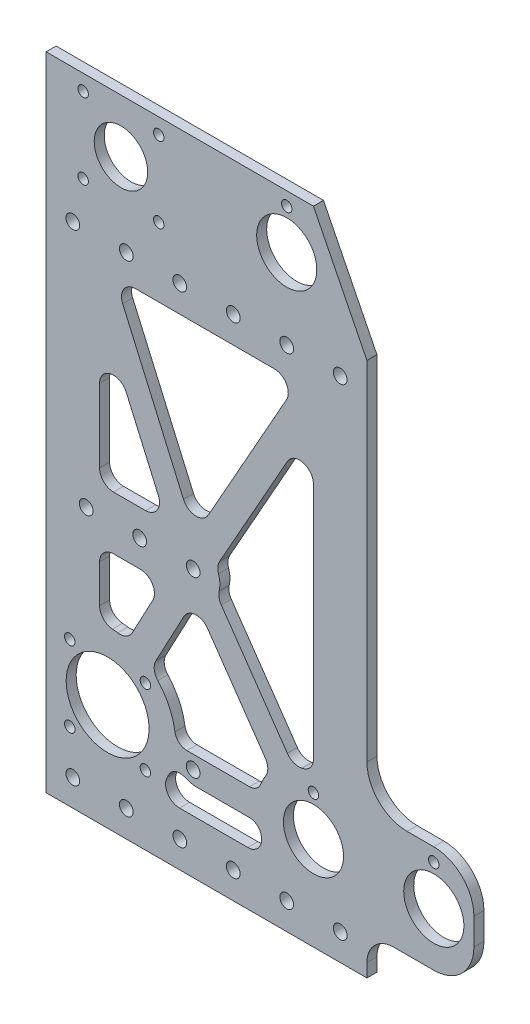
from build123d import *

# Parameters (mm, degrees)
SKETCH1_R           = 3.2639
SKETCH1_R_2         = 14.2875
SKETCH1_R_3         = 2.4892
SKETCH1_R_4         = 12.7
SKETCH1_R_5         = 19.685
BOSS_EXTRUDE1_DEPTH = 4.7625
CUT_EXTRUDE1_DEPTH  = 262.552368382


with BuildPart() as part:
    # Sketch1 → Boss-Extrude1 (new body)
    with BuildSketch(Plane.XY):
        with BuildLine():
            Line((76.2, 0), (76.2, 25.4))
            Line((76.2, 25.4), (50.8, 76.2))
            Line((50.8, 76.2), (12.7, 76.2))
            Line((12.7, 76.2), (-76.2, 76.2))
            Line((-76.2, 76.2), (-76.2, 0))
            Line((-76.2, 0), (-76.2, -228.6))
            Line((-76.2, -228.6), (0, -228.6))
            Line((0, -228.6), (76.2, -228.6))
            Line((76.2, -228.6), (76.2, -222.25))
            ThreePointArc((76.2, -222.25), (79.919743879, -213.269743879), (88.9, -209.55))
            Line((88.9, -209.55), (107.95, -209.55))
            ThreePointArc((107.95, -209.55), (121.420384182, -203.970384182), (127, -190.5))
            Line((127, -190.5), (127, -177.8))
            ThreePointArc((127, -177.8), (121.420384182, -164.329615818), (107.95, -158.75))
            Line((107.95, -158.75), (95.25, -158.75))
            ThreePointArc((95.25, -158.75), (81.779615818, -153.170384182), (76.2, -139.7))
            Line((76.2, -139.7), (76.2, 0))
        make_face()
        with Locations(Location((-38.1, 12.7, 0), (0, 0, 180))):
            Circle(SKETCH1_R, mode=Mode.SUBTRACT)
        with Locations(Location((-12.7, 12.7, 0), (0, 0, 180))):
            Circle(SKETCH1_R, mode=Mode.SUBTRACT)
        with Locations(Location((-63.5, 12.7, 0), (0, 0, 180))):
            Circle(SKETCH1_R, mode=Mode.SUBTRACT)
        with Locations(Location((12.7, 12.7, 0), (0, 0, 180))):
            Circle(SKETCH1_R, mode=Mode.SUBTRACT)
        with Locations(Location((38.1, 12.7, 0), (0, 0, 180))):
            Circle(SKETCH1_R, mode=Mode.SUBTRACT)
        with Locations(Location((38.1, 50.8, 0), (0, 0, 180))):
            Circle(SKETCH1_R_2, mode=Mode.SUBTRACT)
        with Locations(Location((-22.679487758, 32.839487758, 0), (0, 0, 180))):
            Circle(SKETCH1_R_3, mode=Mode.SUBTRACT)
        with Locations(Location((-58.600512242, 32.839487758, 0), (0, 0, 180))):
            Circle(SKETCH1_R_3, mode=Mode.SUBTRACT)
        with Locations(Location((-58.600512242, 68.760512242, 0), (0, 0, 180))):
            Circle(SKETCH1_R_3, mode=Mode.SUBTRACT)
        with Locations(Location((-22.679487758, 68.760512242, 0), (0, 0, 180))):
            Circle(SKETCH1_R_3, mode=Mode.SUBTRACT)
        with Locations(Location((63.5, 12.7, 0), (0, 0, 180))):
            Circle(SKETCH1_R, mode=Mode.SUBTRACT)
        with Locations(Location((-40.64, 50.8, 0), (0, 0, 180))):
            Circle(SKETCH1_R_4, mode=Mode.SUBTRACT)
        with Locations(Location((50.8, -184.15, 0), (0, 0, 180))):
            Circle(SKETCH1_R_2, mode=Mode.SUBTRACT)
        with Locations(Location((63.5, -215.9, 0), (0, 0, 180))):
            Circle(SKETCH1_R, mode=Mode.SUBTRACT)
        with Locations(Location((38.1, -215.9, 0), (0, 0, 180))):
            Circle(SKETCH1_R, mode=Mode.SUBTRACT)
        with Locations(Location((12.7, -215.9, 0), (0, 0, 180))):
            Circle(SKETCH1_R, mode=Mode.SUBTRACT)
        with Locations(Location((50.8, -165.1, 0), (0, 0, 180))):
            Circle(SKETCH1_R_3, mode=Mode.SUBTRACT)
        with Locations(Location((38.1, 69.85, 0), (0, 0, 180))):
            Circle(SKETCH1_R_3, mode=Mode.SUBTRACT)
        with Locations(Location((-6.35, -184.15, 0), (0, 0, 180))):
            Circle(SKETCH1_R, mode=Mode.SUBTRACT)
        with Locations(Location((107.95, -184.15, 0), (0, 0, 180))):
            Circle(SKETCH1_R_2, mode=Mode.SUBTRACT)
        with Locations(Location((107.95, -165.1, 0), (0, 0, 180))):
            Circle(SKETCH1_R_3, mode=Mode.SUBTRACT)
        with Locations(Location((-57.15, -101.6, 0), (0, 0, 180))):
            Circle(SKETCH1_R, mode=Mode.SUBTRACT)
        with Locations(Location((-31.75, -101.6, 0), (0, 0, 180))):
            Circle(SKETCH1_R, mode=Mode.SUBTRACT)
        with Locations(Location((-6.35, -101.6, 0), (0, 0, 180))):
            Circle(SKETCH1_R, mode=Mode.SUBTRACT)
        with Locations(Location((-46.99, -177.8, 0), (0, 0, 180))):
            Circle(SKETCH1_R_5, mode=Mode.SUBTRACT)
        with Locations(Location((-29.029487758, -195.760512242, 0), (0, 0, 180))):
            Circle(SKETCH1_R_3, mode=Mode.SUBTRACT)
        with Locations(Location((-64.950512242, -195.760512242, 0), (0, 0, 180))):
            Circle(SKETCH1_R_3, mode=Mode.SUBTRACT)
        with Locations(Location((-64.950512242, -159.839487758, 0), (0, 0, 180))):
            Circle(SKETCH1_R_3, mode=Mode.SUBTRACT)
        with Locations(Location((-29.029487758, -159.839487758, 0), (0, 0, 180))):
            Circle(SKETCH1_R_3, mode=Mode.SUBTRACT)
        with Locations(Location((-12.7, -215.9, 0), (0, 0, 180))):
            Circle(SKETCH1_R, mode=Mode.SUBTRACT)
        with Locations(Location((-38.1, -215.9, 0), (0, 0, 180))):
            Circle(SKETCH1_R, mode=Mode.SUBTRACT)
        with Locations(Location((-63.5, -215.9, 0), (0, 0, 180))):
            Circle(SKETCH1_R, mode=Mode.SUBTRACT)
    extrude(amount=BOSS_EXTRUDE1_DEPTH)

    # Sketch2 → Cut-Extrude1 (cut, through all)
    with BuildSketch(Plane.XY.offset(4.7625)):
        with BuildLine():
            Line((-12.83077716, -203.2), (19.59926353, -203.2))
            ThreePointArc((19.59926353, -203.2), (25.066064138, -200.300984091), (25.733245747, -194.149149338))
            ThreePointArc((25.733245747, -194.149149338), (25.724761885, -194.127854967), (25.716296113, -194.106553398))
            ThreePointArc((25.716296113, -194.106553398), (23.61470625, -191.486839822), (20.404452937, -190.5))
            Line((20.404452937, -190.5), (-5.477828576, -190.5))
            ThreePointArc((-5.477828576, -190.5), (-6.340017557, -190.434588937), (-7.182470162, -190.239853074))
            Line((-7.182470162, -190.239853074), (-11.035754343, -189.035701768))
            ThreePointArc((-11.035754343, -189.035701768), (-15.003916575, -189.242917347), (-17.877836539, -191.986971616))
            ThreePointArc((-17.877836539, -191.986971616), (-18.23843644, -192.704221477), (-18.616704156, -193.412312704))
            ThreePointArc((-18.616704156, -193.412312704), (-18.515752398, -199.956635736), (-12.83077716, -203.2))
        make_face()
        with BuildLine():
            ThreePointArc((37.978395534, -9.841685227), (37.923146144, -3.269997693), (32.222510687, 0))
            Line((32.222510687, 0), (-33.771257244, 0))
            ThreePointArc((-33.771257244, 0), (-39.298175647, -2.989309284), (-39.821560284, -9.25100758))
            Line((-39.821560284, -9.25100758), (-10.949286814, -75.244775511))
            ThreePointArc((-10.949286814, -75.244775511), (-5.228977015, -79.193518113), (0.856901073, -75.835453158))
            Line((0.856901073, -75.835453158), (37.978395534, -9.841685227))
        make_face()
        with BuildLine():
            ThreePointArc((6.016650935, -104.490665089), (5.959623011, -107.227804875), (7.017552187, -109.752873636))
            Line((7.017552187, -109.752873636), (38.379242123, -155.053092432))
            ThreePointArc((38.379242123, -155.053092432), (41.372935554, -157.43230385), (45.183411581, -157.753426533))
            ThreePointArc((45.183411581, -157.753426533), (45.338775775, -157.720845904), (45.494328922, -157.689179705))
            ThreePointArc((45.494328922, -157.689179705), (49.304178746, -155.399670709), (50.8, -151.214061327))
            Line((50.8, -151.214061327), (50.8, -38.163092112))
            ThreePointArc((50.8, -38.163092112), (45.869462349, -31.774638484), (38.440115153, -34.925406886))
            Line((38.440115153, -34.925406886), (6.201208406, -92.239018879))
            ThreePointArc((6.201208406, -92.239018879), (5.382749443, -94.851548557), (5.694140298, -97.571515859))
            ThreePointArc((5.694140298, -97.571515859), (6.336226337, -101.008678323), (6.016650935, -104.490665089))
        make_face()
        with BuildLine():
            ThreePointArc((28.069846358, -169.60127938), (29.110563089, -165.921638634), (27.937401289, -162.282059163))
            Line((27.937401289, -162.282059163), (0.51656145, -122.674179395))
            ThreePointArc((0.51656145, -122.674179395), (-5.294652738, -119.840268063), (-10.740254608, -123.325477389))
            Line((-10.740254608, -123.325477389), (-24.081589928, -148.340481115))
            ThreePointArc((-24.081589928, -148.340481115), (-24.806096438, -152.278792436), (-23.12177665, -155.911735128))
            ThreePointArc((-23.12177665, -155.911735128), (-17.777951912, -163.819854383), (-14.971403998, -172.94225))
            ThreePointArc((-14.971403998, -172.94225), (-13.046787702, -176.418613316), (-9.321063527, -177.8))
            Line((-9.321063527, -177.8), (20.404452937, -177.8))
            ThreePointArc((20.404452937, -177.8), (23.61470625, -176.813160178), (25.716296113, -174.193446602))
            ThreePointArc((25.716296113, -174.193446602), (26.783063416, -171.840982437), (28.069846358, -169.60127938))
        make_face()
        with BuildLine():
            ThreePointArc((-42.109724533, -145.78482959), (-38.154424423, -145.159684177), (-35.287472281, -142.364010526))
            Line((-35.287472281, -142.364010526), (-25.499607843, -124.011764706))
            ThreePointArc((-25.499607843, -124.011764706), (-25.663783385, -117.506270031), (-31.326666667, -114.3))
            Line((-31.326666667, -114.3), (-44.196, -114.3))
            ThreePointArc((-44.196, -114.3), (-48.865733183, -116.234266817), (-50.8, -120.904))
            Line((-50.8, -120.904), (-50.8, -138.911239606))
            ThreePointArc((-50.8, -138.911239606), (-49.030157857, -143.410543309), (-44.669250814, -145.49826091))
            ThreePointArc((-44.669250814, -145.49826091), (-43.386637762, -145.61609089), (-42.109724533, -145.78482959))
        make_face()
        with BuildLine():
            ThreePointArc((-28.934992756, -88.9), (-23.408074353, -85.910690716), (-22.884689716, -79.64899242))
            Line((-22.884689716, -79.64899242), (-38.14569696, -44.766690148))
            ThreePointArc((-38.14569696, -44.766690148), (-45.548149164, -40.949603929), (-50.8, -47.413697727))
            Line((-50.8, -47.413697727), (-50.8, -82.296))
            ThreePointArc((-50.8, -82.296), (-48.865733183, -86.965733183), (-44.196, -88.9))
            Line((-44.196, -88.9), (-28.934992756, -88.9))
        make_face()
    extrude(amount=-CUT_EXTRUDE1_DEPTH, mode=Mode.SUBTRACT)


solid = part.part
